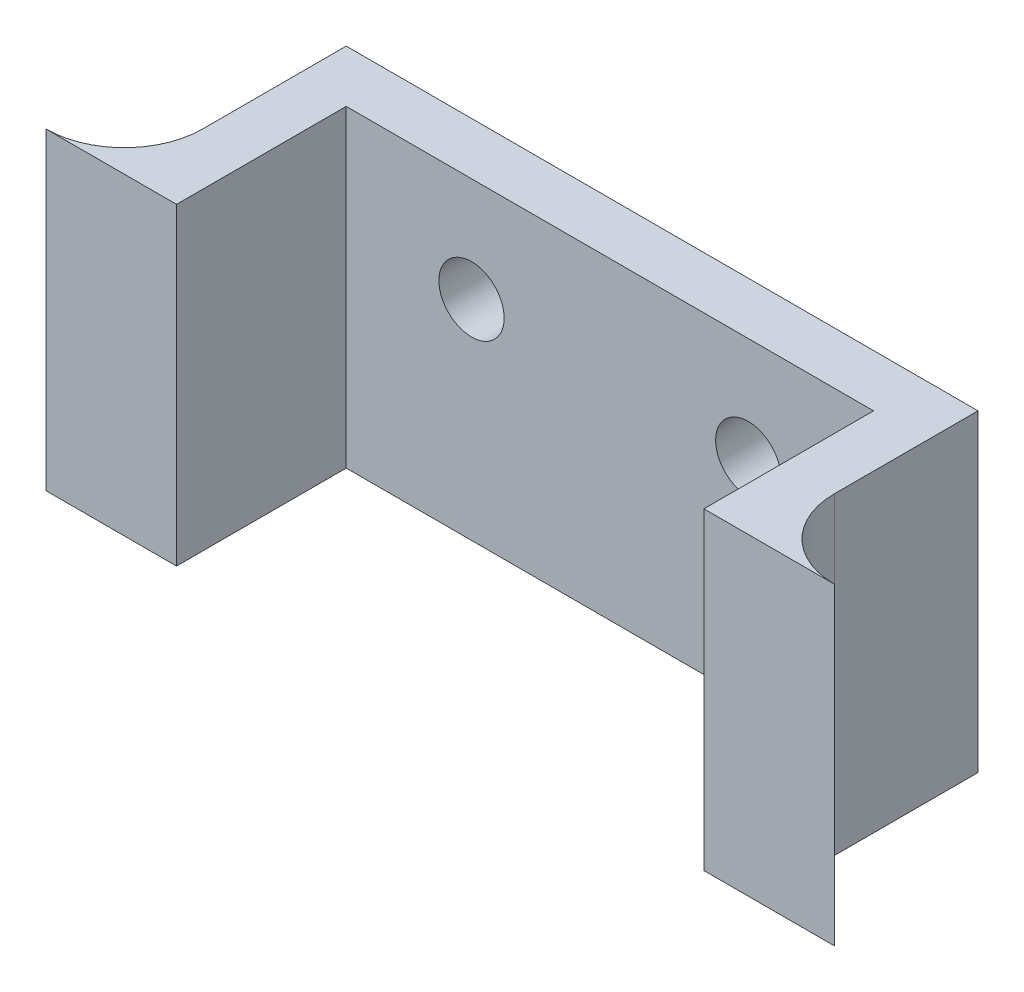
from build123d import *

# Parameters (mm, degrees)
BOSS_EXTRU_1_DEPTH      = 12
ENL_V_MAT_EXTRU_1_REACH = 23.077
ESQUISSE3_R             = 1.25


with BuildPart() as part:
    # Esquisse1 → Boss.-Extru.1 (new body)
    with BuildSketch(Plane(origin=(0, 0, 0), x_dir=(1, 0, 0), z_dir=(0, 1, 0))):
        with BuildLine():
            Line((-10.1, 3.25), (-10.1, -3.25))
            Line((-10.1, -3.25), (-12.1, -3.25))
            Line((-12.1, -3.25), (-15.1, -3.25))
            ThreePointArc((-15.1, -3.25), (-12.978679656, -2.371320344), (-12.1, -0.25))
            Line((-12.1, -0.25), (-12.1, 5.25))
            Line((-12.1, 5.25), (12.1, 5.25))
            Line((12.1, 5.25), (12.1, -0.25))
            ThreePointArc((12.1, -0.25), (12.978679656, -2.371320344), (15.1, -3.25))
            Line((15.1, -3.25), (12.1, -3.25))
            Line((12.1, -3.25), (10.1, -3.25))
            Line((10.1, -3.25), (10.1, 3.25))
            Line((10.1, 3.25), (-10.1, 3.25))
        make_face()
    extrude(amount=BOSS_EXTRU_1_DEPTH)

    # Esquisse3 → Enlèv. mat.-Extru.1 (cut, up to next)
    with BuildSketch(Plane(origin=(0, 0, -5.25), x_dir=(-1, 0, 0), z_dir=(0, 0, -1)), mode=Mode.PRIVATE) as enl_v_mat_extru_1_sk1:
        with Locations((-5.3, 8)):
            Circle(ESQUISSE3_R)
    enl_v_mat_extru_1_tool1 = extrude(enl_v_mat_extru_1_sk1.sketch, amount=-ENL_V_MAT_EXTRU_1_REACH, mode=Mode.PRIVATE) & part.part
    # Esquisse3 → Enlèv. mat.-Extru.1 (cut, up to next)
    with BuildSketch(Plane(origin=(0, 0, -5.25), x_dir=(-1, 0, 0), z_dir=(0, 0, -1)), mode=Mode.PRIVATE) as enl_v_mat_extru_1_sk2:
        with Locations((5.3, 8)):
            Circle(ESQUISSE3_R)
    enl_v_mat_extru_1_tool2 = extrude(enl_v_mat_extru_1_sk2.sketch, amount=-ENL_V_MAT_EXTRU_1_REACH, mode=Mode.PRIVATE) & part.part
    add(enl_v_mat_extru_1_tool1.solids().sort_by_distance((5.3, 8, -5.25))[0], mode=Mode.SUBTRACT)
    add(enl_v_mat_extru_1_tool2.solids().sort_by_distance((-5.3, 8, -5.25))[0], mode=Mode.SUBTRACT)


solid = part.part
